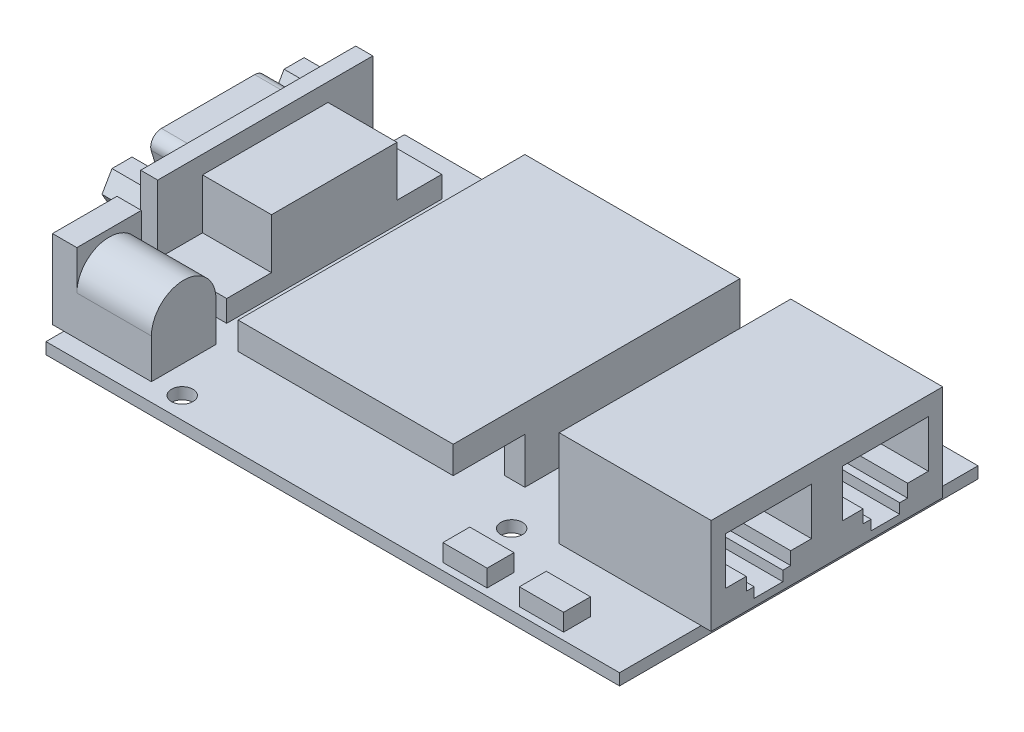
from build123d import *

# Parameters (mm, degrees)
SKETCH_1_W          = 80
SKETCH_1_H          = 50
EXTRUDE_1_DEPTH     = 1.6
SKETCH_2_W          = 21.2
SKETCH_2_H          = 32.3
EXTRUDE_2_DEPTH     = 13.4
CUT_EXTRUDE_1_DEPTH = 12.7
SKETCH_4_W          = 30
SKETCH_4_H          = 40
EXTRUDE_3_DEPTH     = 10.2
SKETCH_5_W          = 24.26
SKETCH_5_H          = 6.4
CUT_EXTRUDE_2_DEPTH = 63.390704436
CUT_EXTRUDE_3_REACH = 69.068
SKETCH_6_W          = 10
SKETCH_6_H          = 6.4
SKETCH_7_W          = 6.17
SKETCH_7_H          = 3.75
EXTRUDE_4_DEPTH     = 2.4
SKETCH_8_R          = 1.5
CUT_EXTRUDE_4_DEPTH = 1.6
EXTRUDE_5_DEPTH     = 13.8
SKETCH_10_W         = 9
SKETCH_10_H         = 11
EXTRUDE_6_DEPTH     = 3.4
SKETCH_11_R         = 3.15
SKETCH_11_R_2       = 0.85
CUT_EXTRUDE_5_DEPTH = 9.6
FILLET_1_R          = 0.8
SKETCH_12_W         = 30
SKETCH_12_H         = 12.5
EXTRUDE_7_DEPTH     = 2.38
SKETCH_13_W         = 9.62
SKETCH_13_H         = 30
EXTRUDE_8_DEPTH     = 3
SKETCH_14_W         = 9.62
SKETCH_14_H         = 17.5
EXTRUDE_9_DEPTH     = 7
SKETCH_15_R         = 1.5
EXTRUDE_10_DEPTH    = 5.6
SKETCH_16_R         = 0.6
CUT_EXTRUDE_6_DEPTH = 5


with BuildPart() as part:
    # 草图1 → 凸台-拉伸1 (new body)
    with BuildSketch(Plane(origin=(0, 0, 0), x_dir=(1, 0, 0), z_dir=(0, 1, 0))):
        Rectangle(SKETCH_1_W, SKETCH_1_H)
    extrude(amount=EXTRUDE_1_DEPTH)

    # 草图2 → 凸台-拉伸2 (add)
    with BuildSketch(Plane(origin=(0, 1.6, 0), x_dir=(1, 0, 0), z_dir=(0, 1, 0))):
        with Locations((30.8, 2.53)):
            Rectangle(SKETCH_2_W, SKETCH_2_H)
    extrude(amount=EXTRUDE_2_DEPTH)

    # 草图3 → 切除-拉伸1 (cut)
    with BuildSketch(Plane(origin=(41.4, 0, 0), x_dir=(0, 0, -1), z_dir=(1, 0, 0))):
        Polygon((0.38, 12.4), (0.38, 5.8), (-2.52, 5.8), (-2.52, 4), (-3.62, 4), (-3.62, 2.6), (-7.62, 2.6), (-7.62, 4), (-8.72, 4), (-8.72, 5.8), (-11.62, 5.8), (-11.62, 12.4), align=None)
        Polygon((12.68, 2.6), (8.68, 2.6), (8.68, 4), (7.58, 4), (7.58, 5.8), (4.68, 5.8), (4.68, 12.4), (16.68, 12.4), (16.68, 5.8), (13.78, 5.8), (13.78, 4), (12.68, 4), align=None)
    extrude(amount=-CUT_EXTRUDE_1_DEPTH, mode=Mode.SUBTRACT)

    # 草图4 → 凸台-拉伸3 (add)
    with BuildSketch(Plane(origin=(0, 1.6, 0), x_dir=(1, 0, 0), z_dir=(0, 1, 0))):
        with Locations((-4, 0.8)):
            Rectangle(SKETCH_4_W, SKETCH_4_H)
    extrude(amount=EXTRUDE_3_DEPTH)

    # 草图5 → 切除-拉伸2 (cut, through all)
    with BuildSketch(Plane.XY.offset(19.2)):
        with Locations((-4, 4.8)):
            Rectangle(SKETCH_5_W, SKETCH_5_H)
    extrude(amount=-CUT_EXTRUDE_2_DEPTH, mode=Mode.SUBTRACT)

    # 切除-拉伸3: up to this face of the body (flat: up to its plane)
    cut_extrude_3_end = Plane(part.part.faces().sort_by_distance((11, 6.7, -0.8))[0])
    # 草图6 → 切除-拉伸3 (cut, up to the picked face)
    with BuildSketch(Plane.ZY.offset(19), mode=Mode.PRIVATE) as cut_extrude_3_sk1:
        with Locations((14.2, 4.8)):
            Rectangle(SKETCH_6_W, SKETCH_6_H)
    cut_extrude_3_tool1 = split(extrude(cut_extrude_3_sk1.sketch, amount=-CUT_EXTRUDE_3_REACH, mode=Mode.PRIVATE), bisect_by=cut_extrude_3_end, keep=Keep.BOTH, mode=Mode.PRIVATE)
    add(cut_extrude_3_tool1.solids().sort_by(Axis((-19, 4.8, 14.2), (1, 0, 0)))[0], mode=Mode.SUBTRACT)

    # 草图7 → 凸台-拉伸4 (add)
    with BuildSketch(Plane(origin=(0, 1.6, 0), x_dir=(1, 0, 0), z_dir=(0, 1, 0))):
        with Locations((17.445, -22.125)):
            Rectangle(SKETCH_7_W, SKETCH_7_H)
        with Locations((28.115, -22.125)):
            Rectangle(SKETCH_7_W, SKETCH_7_H)
    extrude(amount=EXTRUDE_4_DEPTH)

    # 草图8 → 切除-拉伸4 (cut)
    with BuildSketch(Plane(origin=(0, 1.6, 0), x_dir=(1, 0, 0), z_dir=(0, 1, 0))):
        with Locations(Location((16.1, 21.7, 0), (0, 0, 270))):
            Circle(SKETCH_8_R)
        with Locations(Location((15.05, -15.1, 0), (0, 0, 270))):
            Circle(SKETCH_8_R)
        with Locations(Location((-24, -22, 0), (0, 0, 270))):
            Circle(SKETCH_8_R)
        with Locations(Location((-25.7, 21.7, 0), (0, 0, 270))):
            Circle(SKETCH_8_R)
    extrude(amount=-CUT_EXTRUDE_4_DEPTH, mode=Mode.SUBTRACT)

    # 草图9 → 凸台-拉伸5 (add)
    with BuildSketch(Plane.ZY.offset(41.6)):
        with BuildLine():
            Line((13.495843799, 1.6), (22.495843799, 1.6))
            Line((22.495843799, 1.6), (22.495843799, 7.121383857))
            ThreePointArc((22.495843799, 7.121383857), (17.995843799, 11.621383857), (13.495843799, 7.121383857))
            Line((13.495843799, 7.121383857), (13.495843799, 1.6))
        make_face()
    extrude(amount=-EXTRUDE_5_DEPTH)

    # 草图10 → 凸台-拉伸6 (add)
    with BuildSketch(Plane.ZY.offset(41.6)):
        with Locations((17.995843799, 7.1)):
            Rectangle(SKETCH_10_W, SKETCH_10_H)
    extrude(amount=-EXTRUDE_6_DEPTH)

    # 草图11 → 切除-拉伸5 (cut)
    with BuildSketch(Plane.ZY.offset(41.6)):
        with Locations((17.995843799, 7.292957317)):
            Circle(SKETCH_11_R)
        with Locations((17.995843799, 7.292957317)):
            Circle(SKETCH_11_R_2, mode=Mode.SUBTRACT)
    extrude(amount=-CUT_EXTRUDE_5_DEPTH, mode=Mode.SUBTRACT)

    # 圆角1
    fillet_1_edges = [part.edges().sort_by_distance(p)[0] for p in [
        (-41.6, 7.292957317, 17.145843799),
    ]]
    fillet(fillet_1_edges, radius=FILLET_1_R)



with BuildPart() as body_2:
    # 草图12 → 凸台-拉伸7 (new body)
    with BuildSketch(Plane.ZY.offset(41.6)):
        with Locations((-4.804156201, 7.85)):
            Rectangle(SKETCH_12_W, SKETCH_12_H)
    extrude(amount=-EXTRUDE_7_DEPTH)


with BuildPart() as part_1:
    add(part.part)

    add(body_2.part)  # 凸台-拉伸8 merges body 2
    # 草图13 → 凸台-拉伸8 (add)
    with BuildSketch(Plane(origin=(0, 1.6, 0), x_dir=(1, 0, 0), z_dir=(0, 1, 0))):
        with Locations((-34.41, 4.804156201)):
            Rectangle(SKETCH_13_W, SKETCH_13_H)
    extrude(amount=EXTRUDE_8_DEPTH)

    # 草图14 → 凸台-拉伸9 (add)
    with BuildSketch(Plane(origin=(0, 4.6, 0), x_dir=(1, 0, 0), z_dir=(0, 1, 0))):
        with Locations((-34.41, 4.804156201)):
            Rectangle(SKETCH_14_W, SKETCH_14_H)
    extrude(amount=EXTRUDE_9_DEPTH)

    # 草图15 → 凸台-拉伸10 (add)
    # profile 1 of 3: a face of its own
    with BuildSketch(Plane.ZY.offset(41.6)):
        Polygon((-14.009780898, 8.28), (-15.406968549, 10.7), (-18.201343852, 10.7), (-19.598531503, 8.28), (-18.201343852, 5.86), (-15.406968549, 5.86), align=None)
        with Locations((-16.804156201, 8.28)):
            Circle(SKETCH_15_R, mode=Mode.SUBTRACT)
    # profile 2 of 3: a face of its own
    with BuildSketch(Plane.ZY.offset(41.6)):
        Polygon((5.798656148, 5.86), (4.401468497, 8.28), (5.798656148, 10.7), (8.593031451, 10.7), (9.990219102, 8.28), (8.593031451, 5.86), align=None)
        with Locations(Location((7.195843799, 8.28, 0), (0, 0, 180))):
            Circle(SKETCH_15_R, mode=Mode.SUBTRACT)
    # profile 3 of 3: a face of its own
    with BuildSketch(Plane.ZY.offset(41.6)):
        with BuildLine():
            Line((1.695843799, 12.1), (-11.304156201, 12.1))
            ThreePointArc((-11.304156201, 12.1), (-12.507595593, 11.495395794), (-12.740895628, 10.168978172))
            Line((-12.740895628, 10.168978172), (-11.240895628, 5.168978172))
            ThreePointArc((-11.240895628, 5.168978172), (-10.699551995, 4.396560608), (-9.804156201, 4.1))
            Line((-9.804156201, 4.1), (0.195843799, 4.1))
            ThreePointArc((0.195843799, 4.1), (1.091239594, 4.396560608), (1.632583227, 5.168978172))
            Line((1.632583227, 5.168978172), (3.132583227, 10.168978172))
            ThreePointArc((3.132583227, 10.168978172), (2.899283192, 11.495395794), (1.695843799, 12.1))
        make_face()
    extrude(amount=EXTRUDE_10_DEPTH)

    # 草图16 → 切除-拉伸6 (cut)
    with BuildSketch(Plane.ZY.offset(47.2)):
        with Locations((-10.804156201, 9.994214202)):
            Circle(SKETCH_16_R)
        with Locations((-7.804156201, 9.994214202)):
            Circle(SKETCH_16_R)
        with BuildLine():
            ThreePointArc((-4.204156201, 9.994214202), (-4.379892132, 10.41847827), (-4.804156201, 10.594214202))
            Line((-4.804156201, 10.594214202), (-4.804156201, 9.394214202))
            ThreePointArc((-4.804156201, 9.394214202), (-4.379892132, 9.569950133), (-4.204156201, 9.994214202))
        make_face()
        with BuildLine():
            Line((-4.804156201, 9.394214202), (-4.804156201, 10.594214202))
            ThreePointArc((-4.804156201, 10.594214202), (-5.404156201, 9.994214202), (-4.804156201, 9.394214202))
        make_face()
        with Locations((-1.804156201, 9.994214202)):
            Circle(SKETCH_16_R)
        with Locations((1.195843799, 9.994214202)):
            Circle(SKETCH_16_R)
        with Locations((-0.304156201, 7.223993606)):
            Circle(SKETCH_16_R)
        with Locations((-3.304156201, 7.223993606)):
            Circle(SKETCH_16_R)
        with Locations((-6.304156201, 7.223993606)):
            Circle(SKETCH_16_R)
        with Locations((-9.304156201, 7.223993606)):
            Circle(SKETCH_16_R)
    extrude(amount=-CUT_EXTRUDE_6_DEPTH, mode=Mode.SUBTRACT)


solid = part_1.part
